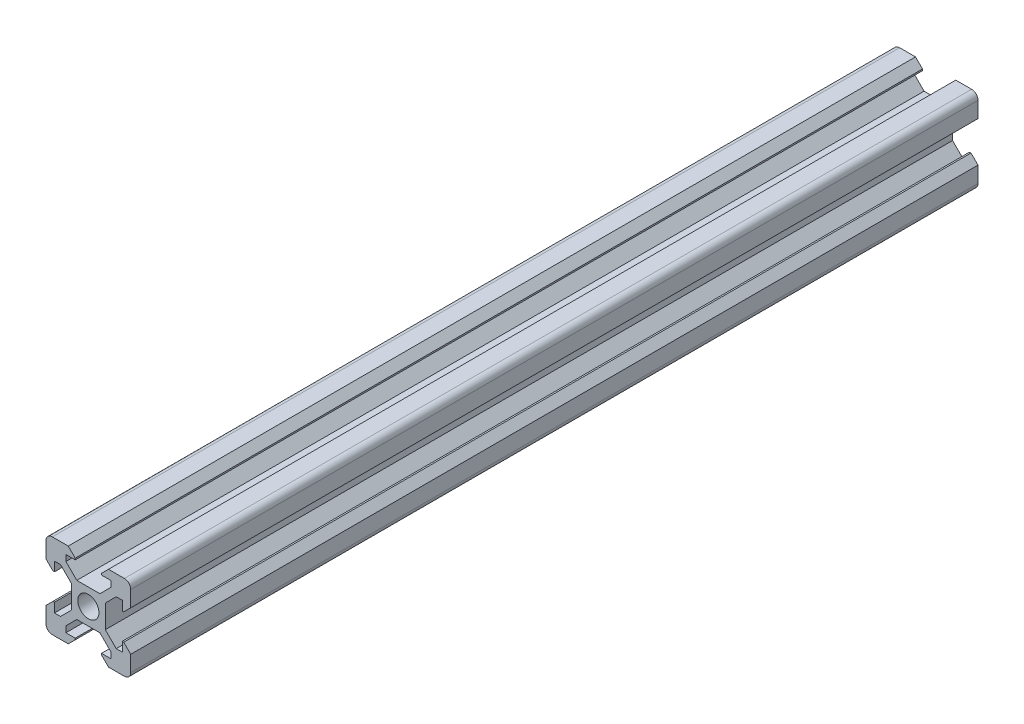
from build123d import *

# Parameters (mm, degrees)
SKETCH2_R           = 2.5
BOSS_EXTRUDE1_DEPTH = 200


with BuildPart() as part:
    # Sketch2 → Boss-Extrude1 (new body)
    with BuildSketch(Plane.XY):
        with BuildLine():
            Line((-4, -2.727207794), (-4, 2.727207794))
            Line((-4, 2.727207794), (-6.572792206, 5.3))
            Line((-6.572792206, 5.3), (-8, 5.3))
            Line((-8, 5.3), (-8, 3.1))
            Line((-8, 3.1), (-8.35, 3.1))
            Line((-8.35, 3.1), (-10, 4.75))
            Line((-10, 4.75), (-10, 8.5))
            ThreePointArc((-10, 8.5), (-9.560660172, 9.560660172), (-8.5, 10))
            Line((-8.5, 10), (-4.75, 10))
            Line((-4.75, 10), (-3.1, 8.35))
            Line((-3.1, 8.35), (-3.1, 8))
            Line((-3.1, 8), (-5.3, 8))
            Line((-5.3, 8), (-5.3, 6.572792206))
            Line((-5.3, 6.572792206), (-2.727207794, 4))
            Line((-2.727207794, 4), (2.727207794, 4))
            Line((2.727207794, 4), (5.3, 6.572792206))
            Line((5.3, 6.572792206), (5.3, 8))
            Line((5.3, 8), (3.1, 8))
            Line((3.1, 8), (3.1, 8.35))
            Line((3.1, 8.35), (4.75, 10))
            Line((4.75, 10), (8.5, 10))
            ThreePointArc((8.5, 10), (9.560660172, 9.560660172), (10, 8.5))
            Line((10, 8.5), (10, 4.75))
            Line((10, 4.75), (8.35, 3.1))
            Line((8.35, 3.1), (8, 3.1))
            Line((8, 3.1), (8, 5.3))
            Line((8, 5.3), (6.572792206, 5.3))
            Line((6.572792206, 5.3), (4, 2.727207794))
            Line((4, 2.727207794), (4, -2.727207794))
            Line((4, -2.727207794), (6.572792206, -5.3))
            Line((6.572792206, -5.3), (8, -5.3))
            Line((8, -5.3), (8, -3.1))
            Line((8, -3.1), (8.35, -3.1))
            Line((8.35, -3.1), (10, -4.75))
            Line((10, -4.75), (10, -8.5))
            ThreePointArc((10, -8.5), (9.560660172, -9.560660172), (8.5, -10))
            Line((8.5, -10), (4.75, -10))
            Line((4.75, -10), (3.1, -8.35))
            Line((3.1, -8.35), (3.1, -8))
            Line((3.1, -8), (5.3, -8))
            Line((5.3, -8), (5.3, -6.572792206))
            Line((5.3, -6.572792206), (2.727207794, -4))
            Line((2.727207794, -4), (-2.727207794, -4))
            Line((-2.727207794, -4), (-5.3, -6.572792206))
            Line((-5.3, -6.572792206), (-5.3, -8))
            Line((-5.3, -8), (-3.1, -8))
            Line((-3.1, -8), (-3.1, -8.35))
            Line((-3.1, -8.35), (-4.75, -10))
            Line((-4.75, -10), (-8.5, -10))
            ThreePointArc((-8.5, -10), (-9.560660172, -9.560660172), (-10, -8.5))
            Line((-10, -8.5), (-10, -4.75))
            Line((-10, -4.75), (-8.35, -3.1))
            Line((-8.35, -3.1), (-8, -3.1))
            Line((-8, -3.1), (-8, -5.3))
            Line((-8, -5.3), (-6.572792206, -5.3))
            Line((-6.572792206, -5.3), (-4, -2.727207794))
        make_face()
        Circle(SKETCH2_R, mode=Mode.SUBTRACT)
    extrude(amount=BOSS_EXTRUDE1_DEPTH)


solid = part.part
